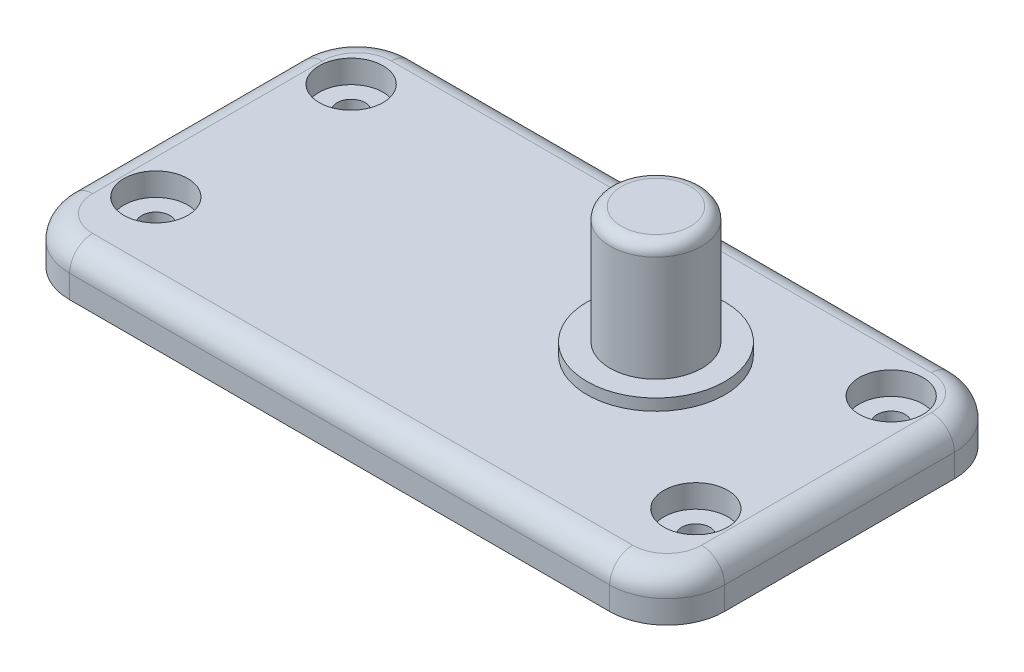
from build123d import *

# Parameters (mm, degrees)
SKETCH1_W                                           = 57
SKETCH1_H                                           = 30
BOSS_EXTRUDE1_DEPTH                                 = 4
SKETCH3_R                                           = 4
BOSS_EXTRUDE2_DEPTH                                 = 11.2
SKETCH4_R                                           = 6
BOSS_EXTRUDE3_DEPTH                                 = 1
CBORE_FOR_2_BINDING_HEAD_MACHINE_SCREW1_D           = 2.4384
CBORE_FOR_2_BINDING_HEAD_MACHINE_SCREW1_CBORE_D     = 5.55752
CBORE_FOR_2_BINDING_HEAD_MACHINE_SCREW1_CBORE_DEPTH = 2.000000064
FILLET1_R                                           = 5
FILLET2_R                                           = 2
FILLET3_R                                           = 1


with BuildPart() as part:
    # Sketch1 → Boss-Extrude1 (new body)
    with BuildSketch(Plane(origin=(0, 0, 0), x_dir=(1, 0, 0), z_dir=(0, 1, 0))):
        Rectangle(SKETCH1_W, SKETCH1_H)
    extrude(amount=BOSS_EXTRUDE1_DEPTH)

    # Sketch3 → Boss-Extrude2 (add)
    with BuildSketch(Plane(origin=(0, 4, 0), x_dir=(1, 0, 0), z_dir=(0, 1, 0))):
        with Locations(Location((10.18, 2.35, 0), (0, 0, 90))):
            Circle(SKETCH3_R)
    extrude(amount=BOSS_EXTRUDE2_DEPTH)

    # Sketch4 → Boss-Extrude3 (add)
    with BuildSketch(Plane(origin=(0, 4, 0), x_dir=(1, 0, 0), z_dir=(0, 1, 0))):
        with Locations(Location((10.18, 2.35, 0), (0, 0, 90))):
            Circle(SKETCH4_R)
    extrude(amount=BOSS_EXTRUDE3_DEPTH)

    # CBORE for #2 Binding Head Machine Screw1 (through all)
    with Locations(Plane(origin=(0, 4, 0), x_dir=(1, 0, 0), z_dir=(0, 1, 0))):
        with Locations((-23.5, 9.5), (-23.5, -7.5), (23.5, -7.5), (23.5, 9.5)):
            CounterBoreHole(CBORE_FOR_2_BINDING_HEAD_MACHINE_SCREW1_D / 2, CBORE_FOR_2_BINDING_HEAD_MACHINE_SCREW1_CBORE_D / 2, CBORE_FOR_2_BINDING_HEAD_MACHINE_SCREW1_CBORE_DEPTH)

    # Fillet1
    fillet1_edges = [part.edges().sort_by_distance(p)[0] for p in [
        (-28.5, 2, -15),
        (28.5, 2, -15),
        (28.5, 2, 15),
        (-28.5, 2, 15),
    ]]
    fillet(fillet1_edges, radius=FILLET1_R)

    # Fillet2
    fillet2_edges = [part.edges().sort_by_distance(p)[0] for p in [
        (0, 4, 15),
        (-28.5, 4, 0),
        (28.5, 4, 0),
        (0, 4, -15),
        (27.035533906, 4, 13.535533906),
        (27.035533906, 4, -13.535533906),
        (-27.035533906, 4, -13.535533906),
        (-27.035533906, 4, 13.535533906),
    ]]
    fillet(fillet2_edges, radius=FILLET2_R)

    # Fillet3
    fillet3_edges = [part.edges().sort_by_distance(p)[0] for p in [
        (10.18, 15.2, 1.65),
    ]]
    fillet(fillet3_edges, radius=FILLET3_R)


solid = part.part
